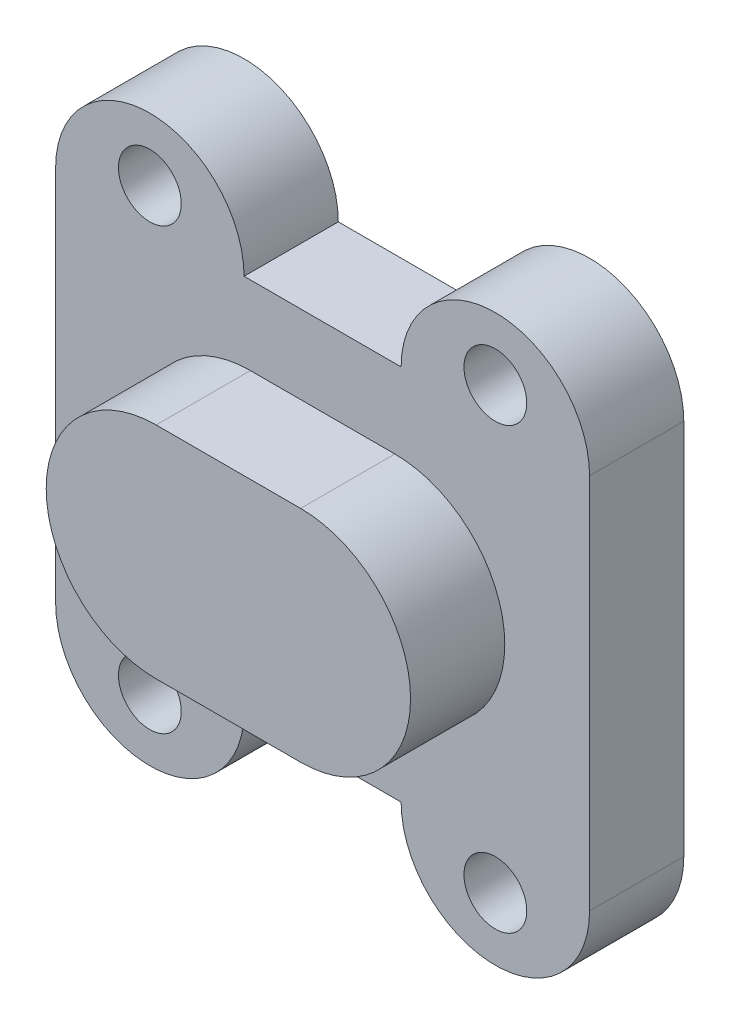
from build123d import *

# Parameters (mm, degrees)
SKETCH_1_R      = 1
EXTRUDE_1_DEPTH = 3
EXTRUDE_2_DEPTH = 3


with BuildPart() as part:
    # 草图1 → 凸台-拉伸1 (new body)
    with BuildSketch(Plane.XY):
        with BuildLine():
            Line((3, -13), (8, -13))
            ThreePointArc((8, -13), (11, -16), (14, -13))
            Line((14, -13), (14, -1))
            ThreePointArc((14, -1), (11, 2), (8, -1))
            Line((8, -1), (3, -1))
            ThreePointArc((3, -1), (0, 2), (-3, -1))
            Line((-3, -1), (-3, -13))
            ThreePointArc((-3, -13), (0, -16), (3, -13))
        make_face()
        with Locations((11, -14)):
            Circle(SKETCH_1_R, mode=Mode.SUBTRACT)
        Circle(SKETCH_1_R, mode=Mode.SUBTRACT)
        with Locations((11, 0)):
            Circle(SKETCH_1_R, mode=Mode.SUBTRACT)
        with Locations((0, -14)):
            Circle(SKETCH_1_R, mode=Mode.SUBTRACT)
    extrude(amount=EXTRUDE_1_DEPTH)

    # 草图2 → 凸台-拉伸2 (add)
    with BuildSketch(Plane.XY.offset(3)):
        with BuildLine():
            Line((3.2, -3.5), (7.8, -3.5))
            ThreePointArc((7.8, -3.5), (11.3, -7), (7.8, -10.5))
            Line((7.8, -10.5), (3.2, -10.5))
            ThreePointArc((3.2, -10.5), (-0.3, -7), (3.2, -3.5))
        make_face()
    extrude(amount=EXTRUDE_2_DEPTH)


solid = part.part
